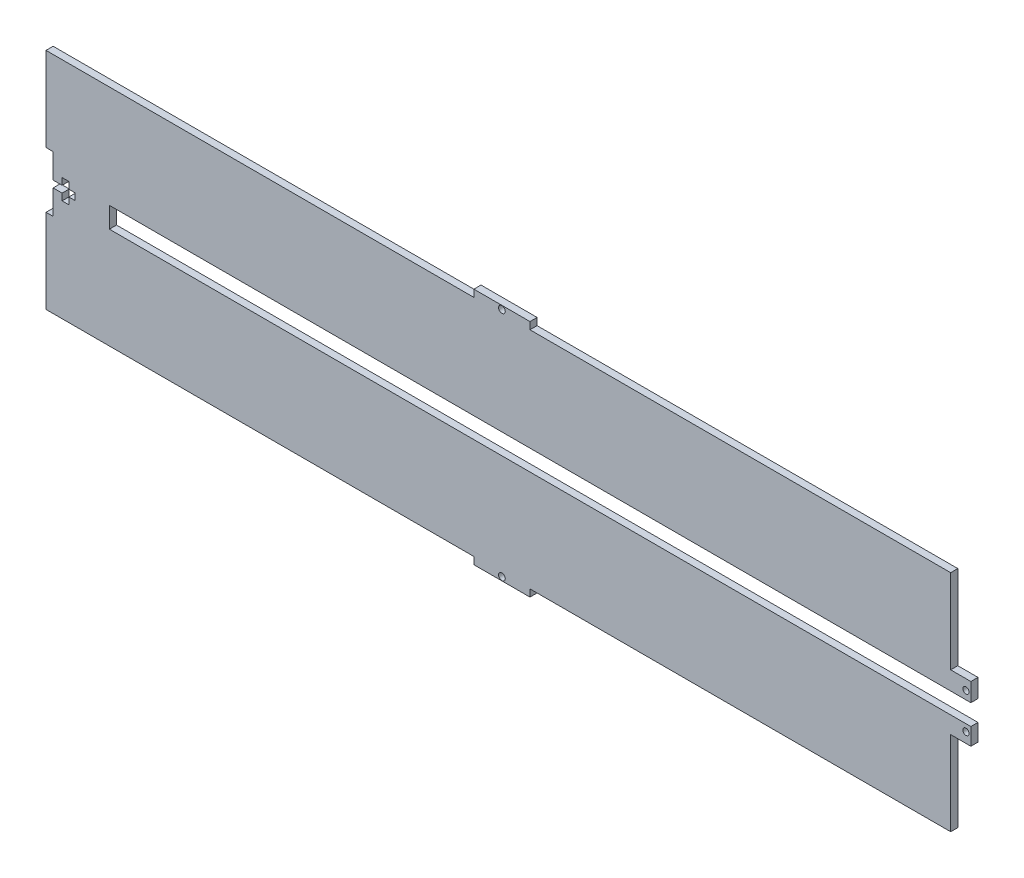
from build123d import *

# Parameters (mm, degrees)
SKETCH1_R           = 1.5
SKETCH1_R_2         = 1.4
BOSS_EXTRUDE1_DEPTH = 3.18
CUT_EXTRUDE1_DEPTH  = 10


with BuildPart() as part:
    # Sketch1 → Boss-Extrude1 (new body)
    with BuildSketch(Plane.XY):
        Polygon((-201.59, 50), (-201.59, 12.5), (-198.41, 12.5), (-198.41, 1.5), (-194.41, 1.5), (-194.41, 4.5), (-191.41, 4.5), (-191.41, 1.5), (-188.59, 1.5), (-188.59, -1.5), (-191.41, -1.5), (-191.41, -4.5), (-194.41, -4.5), (-194.41, -1.5), (-198.41, -1.5), (-198.41, -12.5), (-201.59, -12.5), (-201.59, -50), (-10.91, -50), (-10.91, -53.18), (14.09, -53.18), (14.09, -50), (201.59, -50), (201.59, -12.5), (210.59, -12.5), (210.59, 12.5), (201.59, 12.5), (201.59, 50), (14.09, 50), (14.09, 53.18), (-10.91, 53.18), (-10.91, 50), align=None)
        with Locations(Location((1.59, 51.59, 0), (0, 0, 180))):
            Circle(SKETCH1_R, mode=Mode.SUBTRACT)
        with Locations(Location((1.59, -51.59, 0), (0, 0, 180))):
            Circle(SKETCH1_R, mode=Mode.SUBTRACT)
        with Locations(Location((208.39, 8, 0), (0, 0, 180))):
            Circle(SKETCH1_R_2, mode=Mode.SUBTRACT)
        with Locations(Location((208.39, -8, 0), (0, 0, 180))):
            Circle(SKETCH1_R_2, mode=Mode.SUBTRACT)
    extrude(amount=BOSS_EXTRUDE1_DEPTH)

    # Sketch2 → Cut-Extrude1 (cut)
    with BuildSketch(Plane.XY.offset(3.18)):
        Polygon((-173.347543098, 4.310263234), (152.804450916, 4.310263234), (201.59, 4.310263234), (212.087554944, 4.310263234), (212.087554944, -4.889736766), (201.37, -4.889736766), (196.652456902, -4.889736766), (-173.347543098, -4.889736766), align=None)
    extrude(amount=-CUT_EXTRUDE1_DEPTH, mode=Mode.SUBTRACT)


solid = part.part
